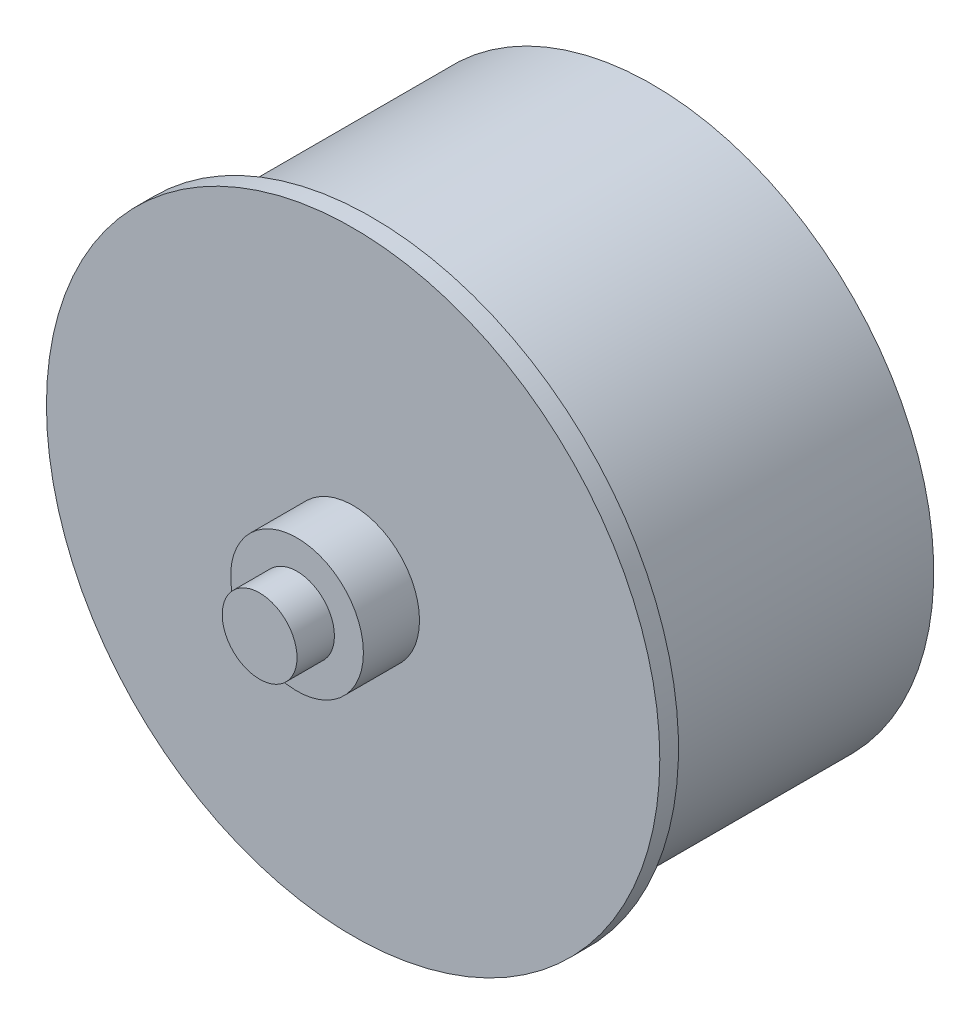
from build123d import *

# Parameters (mm, degrees)
SKETCH_1_R          = 16.4
EXTRUDE_1_DEPTH     = 17
SKETCH_2_R          = 3.55
EXTRUDE_2_DEPTH     = 3
SKETCH_3_R          = 10.075
EXTRUDE_3_DEPTH     = 2
SKETCH_7_R          = 1.05
CUT_EXTRUDE_3_DEPTH = 10
SKETCH3_R           = 16.4
SKETCH3_R_2         = 15.075
CUT_EXTRUDE1_DEPTH  = 16
SKETCH4_R           = 15.075
SKETCH4_R_2         = 10.075
CUT_EXTRUDE2_DEPTH  = 1
SKETCH5_R           = 10.075
CUT_EXTRUDE3_DEPTH  = 1
SKETCH6_R           = 2
BOSS_EXTRUDE1_DEPTH = 2
SKETCH7_R           = 15.075
SKETCH7_R_2         = 15.05
CUT_EXTRUDE4_DEPTH  = 15


with BuildPart() as part:
    # 草图1 → 凸台-拉伸1 (new body)
    with BuildSketch(Plane.XY):
        Circle(SKETCH_1_R)
    extrude(amount=EXTRUDE_1_DEPTH)

    # 草图2 → 凸台-拉伸2 (add)
    with BuildSketch(Plane.XY.offset(17)):
        Circle(SKETCH_2_R)
    extrude(amount=EXTRUDE_2_DEPTH)


with BuildPart() as body_2:
    # 草图3 → 凸台-拉伸3 (new body)
    with BuildSketch(Plane(origin=(0, 0, 0), x_dir=(-1, 0, 0), z_dir=(0, 0, -1))):
        Circle(SKETCH_3_R)
    extrude(amount=EXTRUDE_3_DEPTH)


with BuildPart() as cut_extrude_3_tool:
    # 草图7 → 切除-拉伸3 (new body)
    with BuildSketch(Plane(origin=(0, 0, -2), x_dir=(-1, 0, 0), z_dir=(0, 0, -1))):
        with Locations((0, 8)):
            Circle(SKETCH_7_R)
        with Locations((8, 0)):
            Circle(SKETCH_7_R)
        with Locations((0, -8)):
            Circle(SKETCH_7_R)
        with Locations((-8, 0)):
            Circle(SKETCH_7_R)
    extrude(amount=-CUT_EXTRUDE_3_DEPTH)


with BuildPart() as part_1:
    add(part.part)

    # 切除-拉伸3: cut by cut_extrude_3_tool
    add(cut_extrude_3_tool.part, mode=Mode.SUBTRACT)

    # Sketch3 → Cut-Extrude1 (cut)
    with BuildSketch(Plane(origin=(0, 0, 0), x_dir=(-1, 0, 0), z_dir=(0, 0, -1))):
        Circle(SKETCH3_R)
        Circle(SKETCH3_R_2, mode=Mode.SUBTRACT)
    extrude(amount=-CUT_EXTRUDE1_DEPTH, mode=Mode.SUBTRACT)

    # Sketch4 → Cut-Extrude2 (cut)
    with BuildSketch(Plane(origin=(0, 0, 0), x_dir=(-1, 0, 0), z_dir=(0, 0, -1))):
        Circle(SKETCH4_R)
        Circle(SKETCH4_R_2, mode=Mode.SUBTRACT)
    extrude(amount=-CUT_EXTRUDE2_DEPTH, mode=Mode.SUBTRACT)

    # Sketch6 → Boss-Extrude1 (add)
    with BuildSketch(Plane.XY.offset(20)):
        Circle(SKETCH6_R)
    extrude(amount=BOSS_EXTRUDE1_DEPTH)

    # Sketch7 → Cut-Extrude4 (cut)
    with BuildSketch(Plane(origin=(0, 0, 1), x_dir=(-1, 0, 0), z_dir=(0, 0, -1))):
        Circle(SKETCH7_R)
        Circle(SKETCH7_R_2, mode=Mode.SUBTRACT)
    extrude(amount=-CUT_EXTRUDE4_DEPTH, mode=Mode.SUBTRACT)


with BuildPart() as body_2_1:
    add(body_2.part)

    # 切除-拉伸3: cut by cut_extrude_3_tool
    add(cut_extrude_3_tool.part, mode=Mode.SUBTRACT)

    # Sketch5 → Cut-Extrude3 (cut)
    with BuildSketch(Plane(origin=(0, 0, -2), x_dir=(-1, 0, 0), z_dir=(0, 0, -1))):
        Circle(SKETCH5_R)
    extrude(amount=-CUT_EXTRUDE3_DEPTH, mode=Mode.SUBTRACT)


solid = Compound([part_1.part, body_2_1.part])
